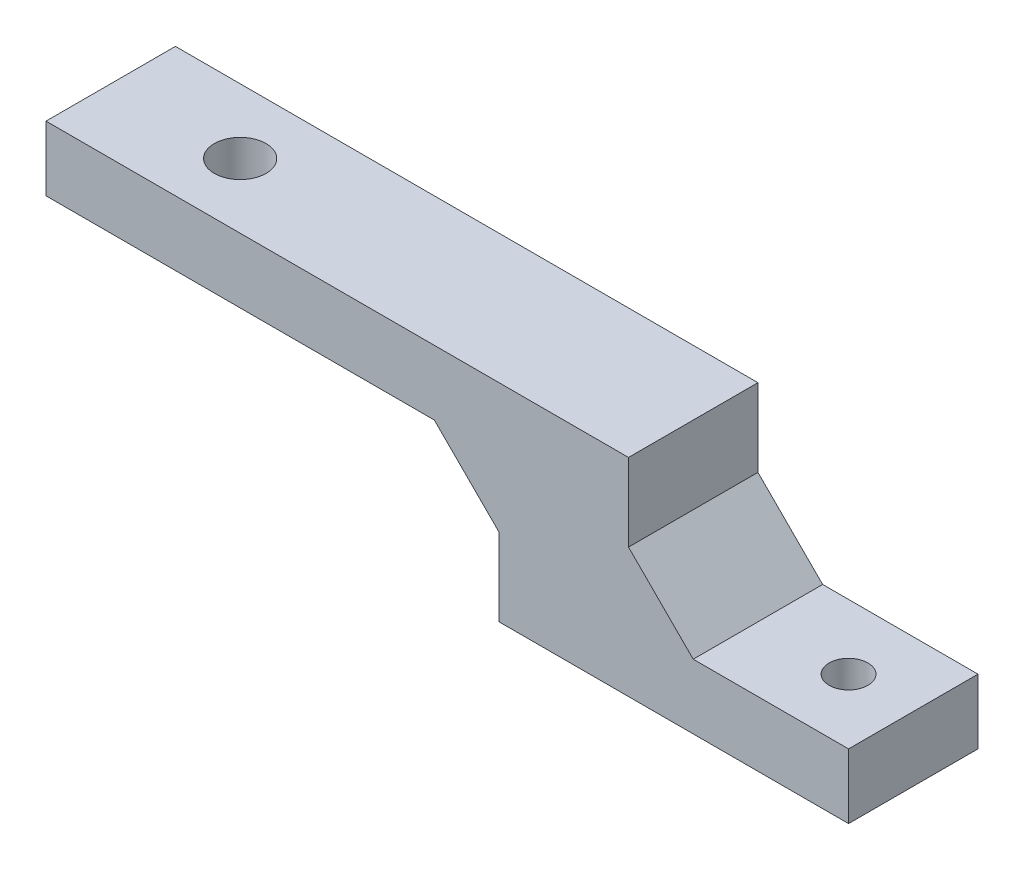
from build123d import *

# Parameters (mm, degrees)
EXTRUDE_1_DEPTH     = 10
SKETCH_3_R          = 2
SKETCH_3_R_2        = 1.5
CUT_EXTRUDE_1_DEPTH = 30
CHAMFER_1_SIZE      = 5


with BuildPart() as part:
    # 草图1 → 凸台-拉伸1 (new body)
    with BuildSketch(Plane.XY):
        Polygon((0, 0), (35, 0), (35, -11), (62, -11), (62, -6), (45, -6), (45, 5), (0, 5), align=None)
    extrude(amount=EXTRUDE_1_DEPTH)

    # 草图3 → 切除-拉伸1 (cut)
    with BuildSketch(Plane.XZ.offset(11)):
        with Locations(Location((10, 5, 0), (0, 0, 270))):
            Circle(SKETCH_3_R)
        with Locations((57, 5)):
            Circle(SKETCH_3_R_2)
    extrude(amount=-CUT_EXTRUDE_1_DEPTH, mode=Mode.SUBTRACT)

    # 倒角1
    chamfer_1_edges = [part.edges().sort_by_distance(p)[0] for p in [
        (45, -6, 5),
        (35, 0, 5),
    ]]
    chamfer(chamfer_1_edges, length=CHAMFER_1_SIZE)


solid = part.part
